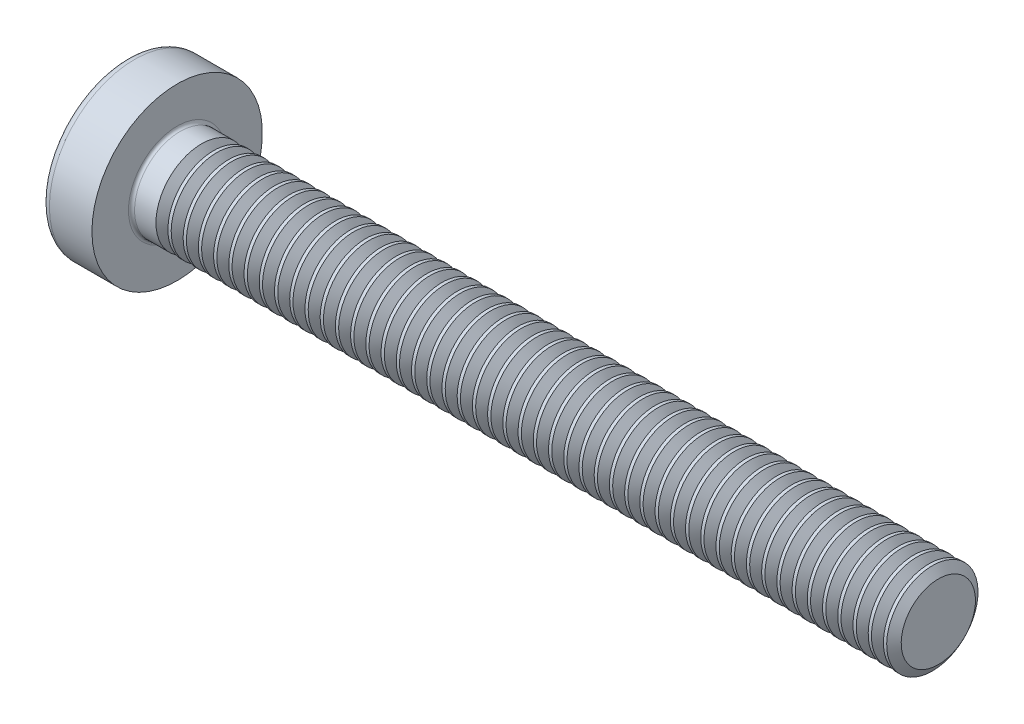
from build123d import *

# Parameters (mm, degrees)
FILLET1_R       = 0.1
RECPAT_COUNT    = 2
RECPAT_ANGLE    = 90
THDSCHPAT_COUNT = 49
THDSCHPAT_PITCH = 0.5


with BuildPart() as part:
    # BodySke → Base-Revolve (revolve)
    with BuildSketch(Plane.XY, mode=Mode.PRIVATE) as base_revolve_sk:
        with BuildLine():
            Line((2.4, 1.5), (2.4, 2.8))
            Line((2.4, 2.8), (1.003501533, 2.8))
            ThreePointArc((1.003501533, 2.8), (0.873295971, 2.76653015), (0.775371599, 2.674418605))
            ThreePointArc((0.775371599, 2.674418605), (0.197753546, 1.392274756), (0, 0))
            Line((0, 0), (27.4, 0))
            Line((27.4, 0), (27.4, 1.5))
            Line((27.4, 1.5), (2.4, 1.5))
        make_face()
    revolve(base_revolve_sk.sketch.rotate(Axis((1.003501533, 0, 0), (1, 0, 0)), 90), axis=Axis((1.003501533, 0, 0), (1, 0, 0)))

    # Fillet1
    fillet1_edges = [part.edges().sort_by_distance(p)[0] for p in [
        (2.4, 0, -1.5),
    ]]
    fillet(fillet1_edges, radius=FILLET1_R)

    # Sketch3 → Recess section 0
    with BuildSketch(Plane(origin=(0, 0, 0), x_dir=(0, 0, -1), z_dir=(1, 0, 0))):
        with BuildLine():
            Line((0.37, -1.4), (-0.37, -1.4))
            Line((-0.37, -1.4), (-0.37, 1.4))
            Line((-0.37, 1.4), (0.37, 1.4))
            Line((0.37, 1.4), (0.37, -1.4))
        make_face()
    # Sketch4 → Recess section 1
    with BuildSketch(Plane(origin=(1.75, 0, 0), x_dir=(0, 0, -1), z_dir=(1, 0, 0))):
        with BuildLine():
            Line((0.37, -0.527482216), (-0.37, -0.527482216))
            Line((-0.37, -0.527482216), (-0.37, 0.527482216))
            Line((-0.37, 0.527482216), (0.37, 0.527482216))
            Line((0.37, 0.527482216), (0.37, -0.527482216))
        make_face()
    recess = loft(mode=Mode.SUBTRACT)

    # RecPat: Recess ×2 about axis
    recpat_axis = Axis((0, 0, 0), (1, 0, 0))
    for i in range(1, RECPAT_COUNT):
        add(recess.rotate(recpat_axis, i * RECPAT_ANGLE / (RECPAT_COUNT - 1)), mode=Mode.SUBTRACT)

    # RecCorSke → RecessCore (revolve, cut)
    with BuildSketch(Plane.XY, mode=Mode.PRIVATE) as recesscore_sk:
        Polygon((0, 0), (0, 0.678371921), (1.75, 0.556), (1.930655351, 0), align=None)
    revolve(recesscore_sk.sketch.rotate(Axis((-3.175, 0, 0), (1, 0, 0)), 15.814025764), axis=Axis((-3.175, 0, 0), (1, 0, 0)), mode=Mode.SUBTRACT)

    # ThdSchSke → ThreadSchematic (revolve, cut)
    with BuildSketch(Plane.XY, mode=Mode.PRIVATE) as threadschematic_sk:
        Polygon((3.4, -1.2195), (3.203591786, -1.5), (3.203591786, -1.875), (3.596408214, -1.875), (3.596408214, -1.5), align=None)
    threadschematic = revolve(threadschematic_sk.sketch.rotate(Axis((-3.175, 0, 0), (1, 0, 0)), 270), axis=Axis((-3.175, 0, 0), (1, 0, 0)), mode=Mode.SUBTRACT)

    # ThdSchPat: ThreadSchematic ×49
    with Locations(*[(i * THDSCHPAT_PITCH, 0, 0) for i in range(1, THDSCHPAT_COUNT)]):
        add(threadschematic, mode=Mode.SUBTRACT)


solid = part.part
